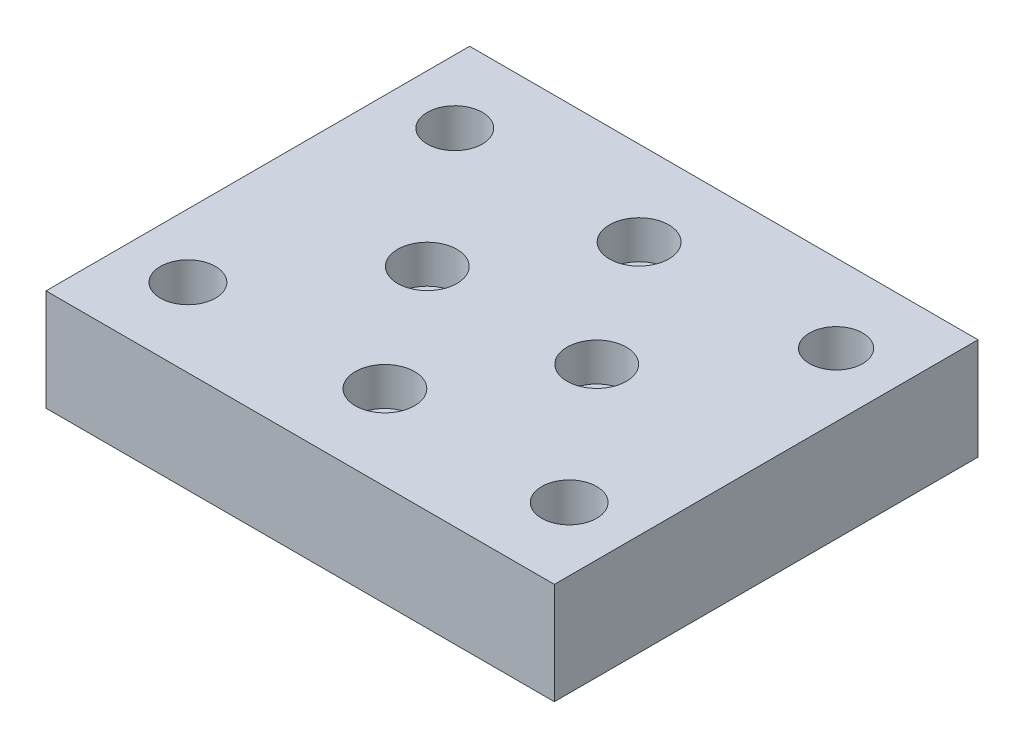
from build123d import *

# Parameters (mm, degrees)
CROQUIS1_W              = 120
CROQUIS1_H              = 100
SALIENTE_EXTRUIR1_DEPTH = 24
CROQUIS2_R              = 7
CORTAR_EXTRUIR1_DEPTH   = 9
CORTAR_EXTRUIR2_REACH   = 81.53
CROQUIS3_R              = 4.5
CROQUIS4_R              = 9.5
CORTAR_EXTRUIR3_DEPTH   = 13
CROQUIS5_R              = 6.5
CROQUIS5_R_2            = 6.276895532
CORTAR_EXTRUIR4_DEPTH   = 80.177016867


with BuildPart() as part:
    # Croquis1 → Saliente-Extruir1 (new body)
    with BuildSketch(Plane(origin=(0, 0, 0), x_dir=(1, 0, 0), z_dir=(0, 1, 0))):
        Rectangle(CROQUIS1_W, CROQUIS1_H)
    extrude(amount=SALIENTE_EXTRUIR1_DEPTH)

    # Croquis2 → Cortar-Extruir1 (cut)
    with BuildSketch(Plane(origin=(0, 24, 0), x_dir=(1, 0, 0), z_dir=(0, 1, 0))):
        with Locations(Location((0, 30, 0), (0, 0, 270))):
            Circle(CROQUIS2_R)
        with Locations(Location((0, -30, 0), (0, 0, 270))):
            Circle(CROQUIS2_R)
        with Locations(Location((-20, 0, 0), (0, 0, 270))):
            Circle(CROQUIS2_R)
        with Locations(Location((20, 0, 0), (0, 0, 270))):
            Circle(CROQUIS2_R)
    extrude(amount=-CORTAR_EXTRUIR1_DEPTH, mode=Mode.SUBTRACT)

    # Croquis3 → Cortar-Extruir2 (cut, up to next)
    with BuildSketch(Plane(origin=(0, 15, 0), x_dir=(1, 0, 0), z_dir=(0, 1, 0)), mode=Mode.PRIVATE) as cortar_extruir2_sk1:
        with Locations(Location((-20, 0, 0), (0, 0, 270))):
            Circle(CROQUIS3_R)
    cortar_extruir2_tool1 = extrude(cortar_extruir2_sk1.sketch, amount=-CORTAR_EXTRUIR2_REACH, mode=Mode.PRIVATE) & part.part
    # Croquis3 → Cortar-Extruir2 (cut, up to next)
    with BuildSketch(Plane(origin=(0, 15, 0), x_dir=(1, 0, 0), z_dir=(0, 1, 0)), mode=Mode.PRIVATE) as cortar_extruir2_sk2:
        with Locations(Location((0, 30, 0), (0, 0, 270))):
            Circle(CROQUIS3_R)
    cortar_extruir2_tool2 = extrude(cortar_extruir2_sk2.sketch, amount=-CORTAR_EXTRUIR2_REACH, mode=Mode.PRIVATE) & part.part
    # Croquis3 → Cortar-Extruir2 (cut, up to next)
    with BuildSketch(Plane(origin=(0, 15, 0), x_dir=(1, 0, 0), z_dir=(0, 1, 0)), mode=Mode.PRIVATE) as cortar_extruir2_sk3:
        with Locations(Location((20, 0, 0), (0, 0, 270))):
            Circle(CROQUIS3_R)
    cortar_extruir2_tool3 = extrude(cortar_extruir2_sk3.sketch, amount=-CORTAR_EXTRUIR2_REACH, mode=Mode.PRIVATE) & part.part
    # Croquis3 → Cortar-Extruir2 (cut, up to next)
    with BuildSketch(Plane(origin=(0, 15, 0), x_dir=(1, 0, 0), z_dir=(0, 1, 0)), mode=Mode.PRIVATE) as cortar_extruir2_sk4:
        with Locations(Location((0, -30, 0), (0, 0, 270))):
            Circle(CROQUIS3_R)
    cortar_extruir2_tool4 = extrude(cortar_extruir2_sk4.sketch, amount=-CORTAR_EXTRUIR2_REACH, mode=Mode.PRIVATE) & part.part
    add(cortar_extruir2_tool1.solids().sort_by_distance((-20, 15, 0))[0], mode=Mode.SUBTRACT)
    add(cortar_extruir2_tool2.solids().sort_by_distance((0, 15, -30))[0], mode=Mode.SUBTRACT)
    add(cortar_extruir2_tool3.solids().sort_by_distance((20, 15, 0))[0], mode=Mode.SUBTRACT)
    add(cortar_extruir2_tool4.solids().sort_by_distance((0, 15, 30))[0], mode=Mode.SUBTRACT)

    # Croquis4 → Cortar-Extruir3 (cut)
    with BuildSketch(Plane.XZ):
        with Locations(Location((-45, 31.5, 0), (0, 0, 270))):
            Circle(CROQUIS4_R)
        with Locations(Location((45, 31.5, 0), (0, 0, 270))):
            Circle(CROQUIS4_R)
        with Locations(Location((45, -31.5, 0), (0, 0, 270))):
            Circle(CROQUIS4_R)
        with Locations(Location((-45, -31.5, 0), (0, 0, 270))):
            Circle(CROQUIS4_R)
    extrude(amount=-CORTAR_EXTRUIR3_DEPTH, mode=Mode.SUBTRACT)

    # Croquis5 → Cortar-Extruir4 (cut, through all)
    with BuildSketch(Plane.XZ.offset(-13)):
        with Locations(Location((-45, 31.5, 0), (0, 0, 270))):
            Circle(CROQUIS5_R)
        with Locations(Location((45, 31.5, 0), (0, 0, 270))):
            Circle(CROQUIS5_R)
        with Locations(Location((-45, -31.5, 0), (0, 0, 270))):
            Circle(CROQUIS5_R)
        with Locations(Location((45, -31.5, 0), (0, 0, 270))):
            Circle(CROQUIS5_R_2)
    extrude(amount=-CORTAR_EXTRUIR4_DEPTH, mode=Mode.SUBTRACT)


solid = part.part
